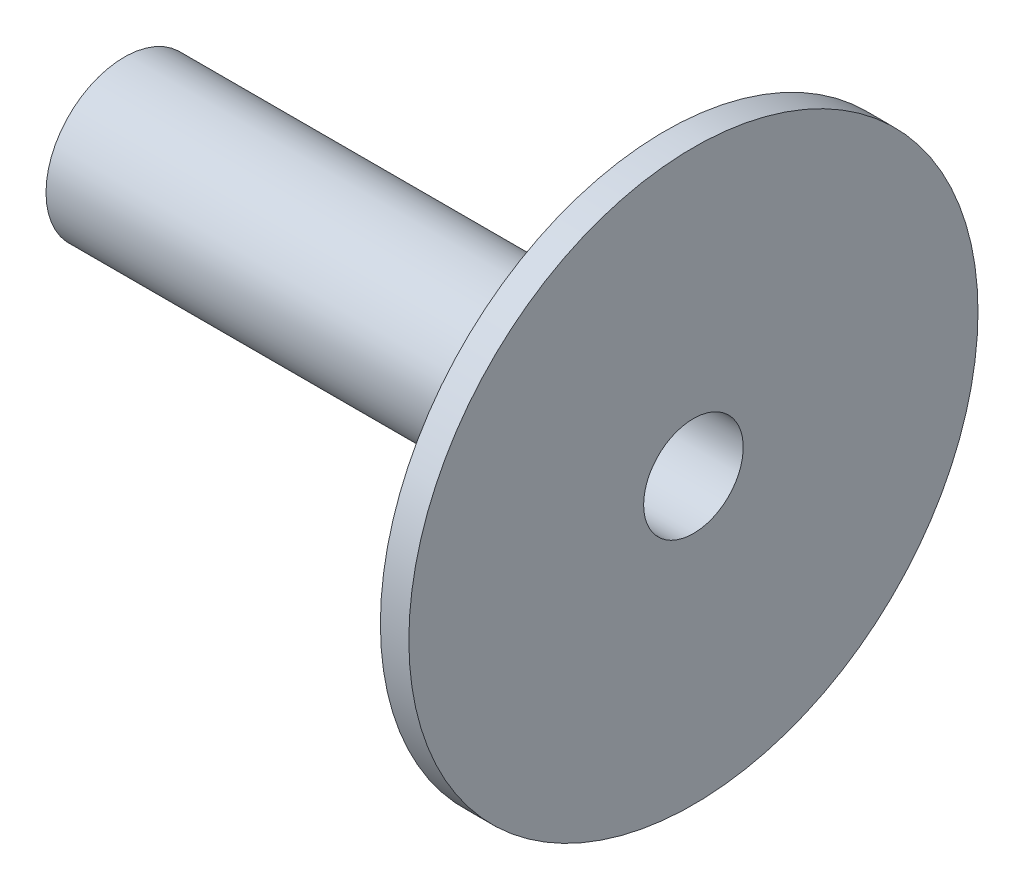
from build123d import *

# Parameters (mm, degrees)
SKETCH1_R           = 20
BOSS_EXTRUDE1_DEPTH = 40
SKETCH2_R           = 20
SKETCH2_R_2         = 5.5
CUT_EXTRUDE1_DEPTH  = 38
SKETCH3_R           = 3.5
CUT_EXTRUDE2_DEPTH  = 40


with BuildPart() as part:
    # Sketch1 → Boss-Extrude1 (new body)
    with BuildSketch(Plane(origin=(0, 0, 0), x_dir=(0, 0, -1), z_dir=(1, 0, 0))):
        Circle(SKETCH1_R)
    extrude(amount=BOSS_EXTRUDE1_DEPTH)

    # Sketch2 → Cut-Extrude1 (cut)
    with BuildSketch(Plane.ZY):
        Circle(SKETCH2_R)
        Circle(SKETCH2_R_2, mode=Mode.SUBTRACT)
    extrude(amount=-CUT_EXTRUDE1_DEPTH, mode=Mode.SUBTRACT)

    # Sketch3 → Cut-Extrude2 (cut)
    with BuildSketch(Plane.ZY):
        Circle(SKETCH3_R)
    extrude(amount=-CUT_EXTRUDE2_DEPTH, mode=Mode.SUBTRACT)


solid = part.part
